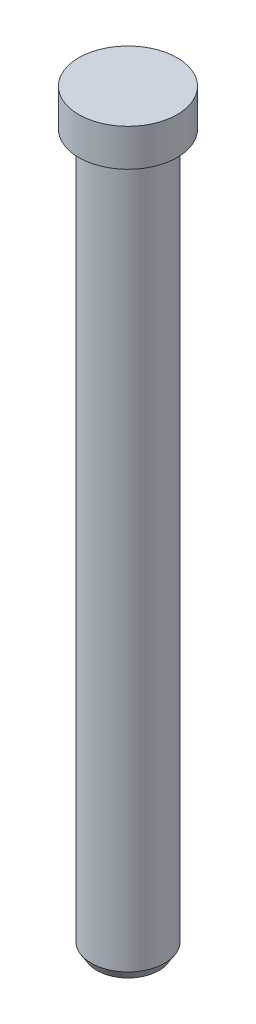
from build123d import *


with BuildPart() as part:
    # Croquis1 → Revolución1 (revolve)
    with BuildSketch(Plane.XY, mode=Mode.PRIVATE) as revoluci_n1_sk:
        Polygon((0, 60.5), (7.9375, 60.5), (7.9375, 54.5), (5.9375, 54.5), (5.9375, -59), (5, -60.5), (0, -60.5), align=None)
    revolve(revoluci_n1_sk.sketch.rotate(Axis((0, 60.5, 0), (0, -1, 0)), 180), axis=Axis((0, 60.5, 0), (0, -1, 0)))


solid = part.part
